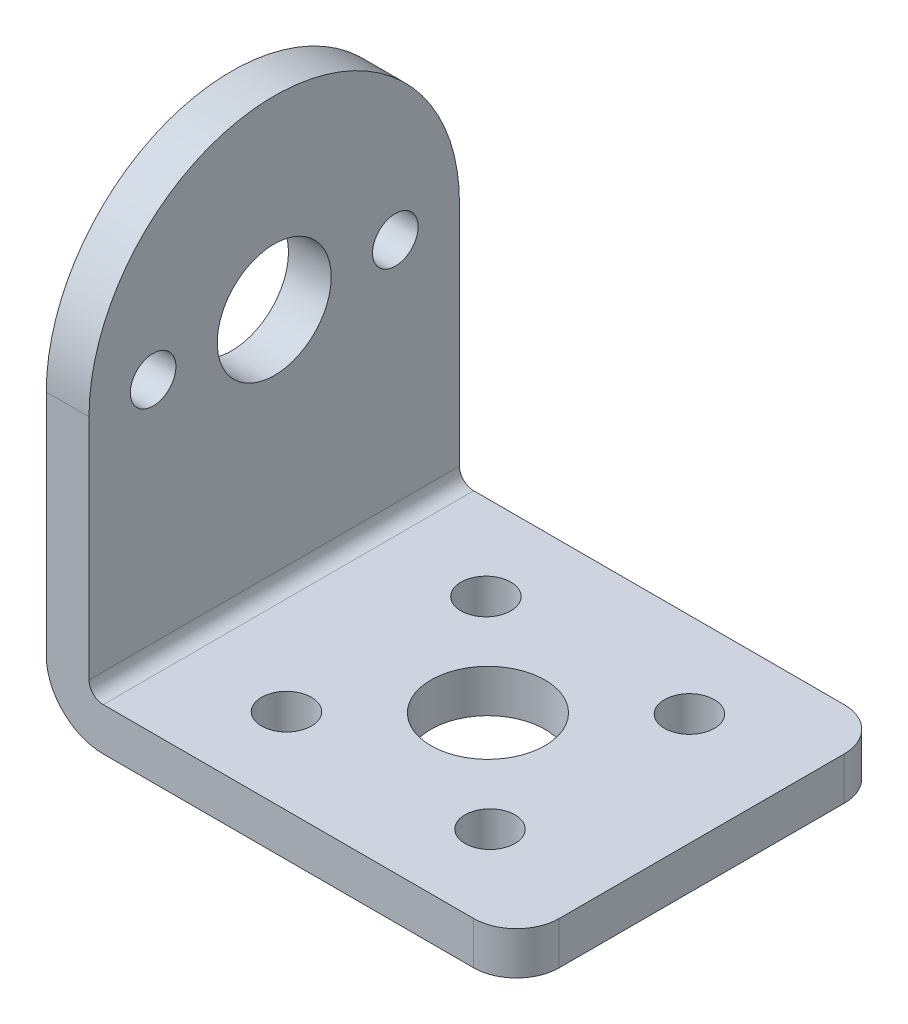
from build123d import *

# Parameters (mm, degrees)
EXTRU_MINCE1_DEPTH      = 13
EXTRU_MINCE1_DEPTH_BACK = 13
ESQUISSE2_R             = 4
ESQUISSE2_R_2           = 1.75
ENL_V_MAT_EXTRU_1_DEPTH = 47.454278597
ESQUISSE3_R             = 4
ESQUISSE3_R_2           = 1.6
ENL_V_MAT_EXTRU_2_DEPTH = 47.454278597
CHANFREIN1_SIZE         = 0.5
CONG_1_R                = 3


with BuildPart() as part:
    # Esquisse1 → Extru.-Mince1 (new, two sides: drawn at the far end of the back side and taken through both)
    with BuildSketch(Plane.XY.offset(-EXTRU_MINCE1_DEPTH_BACK)):
        with BuildLine():
            Line((33, 0), (4, 0))
            ThreePointArc((4, 0), (1.171572875, 1.171572875), (0, 4))
            Line((0, 4), (0, 33))
            Line((0, 33), (3, 33))
            Line((3, 33), (3, 4))
            ThreePointArc((3, 4), (3.292893219, 3.292893219), (4, 3))
            Line((4, 3), (33, 3))
            Line((33, 3), (33, 0))
        make_face()
    extrude(amount=EXTRU_MINCE1_DEPTH + EXTRU_MINCE1_DEPTH_BACK)

    # Esquisse2 → Enlèv. mat.-Extru.1 (cut, through all)
    with BuildSketch(Plane(origin=(0, 3, 0), x_dir=(1, 0, 0), z_dir=(0, 1, 0))):
        with Locations(Location((18, 0, 0), (0, 0, 270))):
            Circle(ESQUISSE2_R)
        with Locations(Location((10.858571571, 7, 0), (0, 0, 270))):
            Circle(ESQUISSE2_R_2)
        with Locations(Location((10.858571571, -7, 0), (0, 0, 90))):
            Circle(ESQUISSE2_R_2)
        with Locations(Location((25.141428429, -7, 0), (0, 0, 270))):
            Circle(ESQUISSE2_R_2)
        with Locations(Location((25.141428429, 7, 0), (0, 0, 90))):
            Circle(ESQUISSE2_R_2)
    extrude(amount=-ENL_V_MAT_EXTRU_1_DEPTH, mode=Mode.SUBTRACT)

    # Esquisse3 → Enlèv. mat.-Extru.2 (cut, through all)
    with BuildSketch(Plane(origin=(3, 0, 0), x_dir=(0, 0, -1), z_dir=(1, 0, 0))):
        with Locations((0, 20)):
            Circle(ESQUISSE3_R)
        with Locations((-8.5, 20)):
            Circle(ESQUISSE3_R_2)
        with Locations(Location((8.5, 20, 0), (0, 0, 180))):
            Circle(ESQUISSE3_R_2)
        with BuildLine():
            Line((13, 20), (15, 20))
            Line((15, 20), (15, 35))
            Line((15, 35), (-15, 35))
            Line((-15, 35), (-15, 20))
            Line((-15, 20), (-13, 20))
            ThreePointArc((-13, 20), (0, 33), (13, 20))
        make_face()
    extrude(amount=-ENL_V_MAT_EXTRU_2_DEPTH, mode=Mode.SUBTRACT)

    # Chanfrein1
    chanfrein1_edges = [part.edges().sort_by_distance(p)[0] for p in [
        (0, 20, -10.1),
        (0, 20, 10.1),
    ]]
    chamfer(chanfrein1_edges, length=CHANFREIN1_SIZE)

    # Congé1
    cong_1_edges = [part.edges().sort_by_distance(p)[0] for p in [
        (33, 1.5, 13),
        (33, 1.5, -13),
    ]]
    fillet(cong_1_edges, radius=CONG_1_R)


solid = part.part
